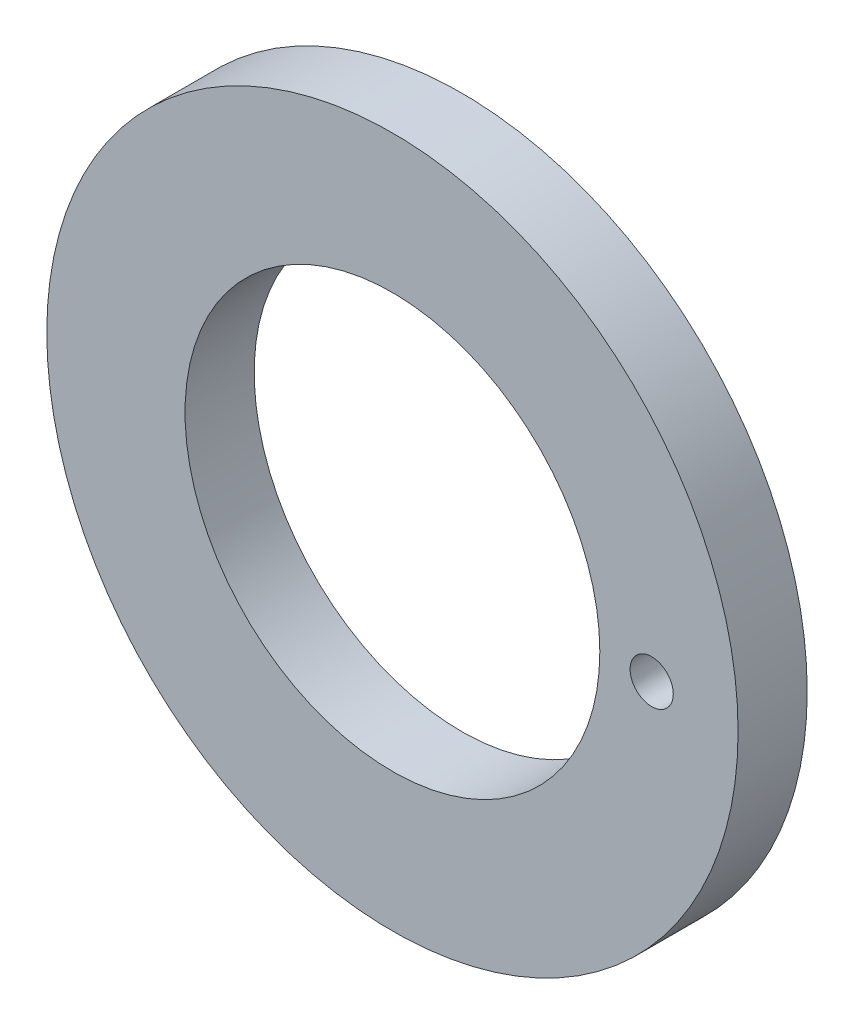
from build123d import *

# Parameters (mm, degrees)
SKETCH1_R           = 25.4
SKETCH1_R_2         = 15.24
BOSS_EXTRUDE1_DEPTH = 5.08
SKETCH2_R           = 1.5875
CUT_EXTRUDE1_DEPTH  = 37.278456417


with BuildPart() as part:
    # Sketch1 → Boss-Extrude1 (new body)
    with BuildSketch(Plane.XY):
        Circle(SKETCH1_R)
        Circle(SKETCH1_R_2, mode=Mode.SUBTRACT)
    extrude(amount=BOSS_EXTRUDE1_DEPTH)

    # Sketch2 → Cut-Extrude1 (cut, through all)
    with BuildSketch(Plane.XY.offset(5.08)):
        with Locations((19.05, 0)):
            Circle(SKETCH2_R)
    extrude(amount=-CUT_EXTRUDE1_DEPTH, mode=Mode.SUBTRACT)


solid = part.part
